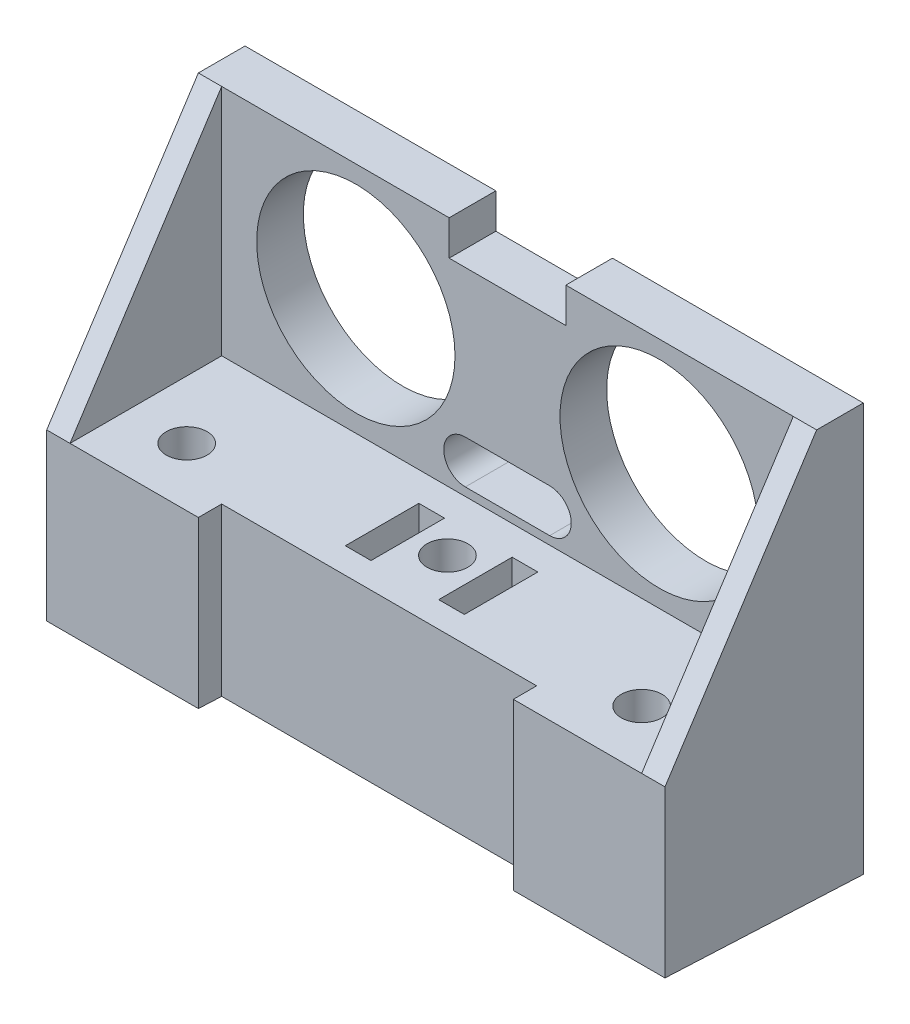
from build123d import *
from build123d.topology import SkipClean

# Parameters (mm, degrees)
SKETCH1_R           = 8.5
BOSS_EXTRUDE1_DEPTH = 4
BOSS_EXTRUDE2_DEPTH = 13
SKETCH3_W           = 2.2
SKETCH3_H           = 6.3
CUT_EXTRUDE1_DEPTH  = 3.5
SKETCH4_R           = 1.75
CUT_EXTRUDE2_DEPTH  = 47.663174732
SKETCH6_W           = 27
SKETCH6_H           = 2
CUT_EXTRUDE4_DEPTH  = 47.663174732
SKETCH7_W           = 2
SKETCH7_H           = 25
BOSS_EXTRUDE3_DEPTH = 17
CUT_EXTRUDE5_DEPTH  = 72
SKETCH9_R           = 1.75
BOSS_EXTRUDE4_DEPTH = 10
SKETCH10_R          = 2.85
CUT_EXTRUDE6_DEPTH  = 12
CUT_EXTRUDE7_DEPTH  = 54


with BuildPart() as part:
    # Sketch1 → Boss-Extrude1 (new body)
    with BuildSketch(Plane.XY):
        Polygon((-10.41954023, 18.706896552), (-10.41954023, -6.293103448), (38.58045977, -6.293103448), (38.58045977, 18.706896552), (19.08045977, 18.706896552), (19.08045977, 15.706896552), (14.08045977, 15.706896552), (9.08045977, 15.706896552), (9.08045977, 18.706896552), align=None)
        with BuildLine():
            ThreePointArc((10.46545977, -0.583103448), (8.61545977, 1.266896552), (10.46545977, 3.116896552))
            Line((10.46545977, 3.116896552), (17.69545977, 3.116896552))
            ThreePointArc((17.69545977, 3.116896552), (19.54545977, 1.266896552), (17.69545977, -0.583103448))
            Line((17.69545977, -0.583103448), (10.46545977, -0.583103448))
        make_face(mode=Mode.SUBTRACT)
        with Locations((1.08045977, 8.706896552)):
            Circle(SKETCH1_R, mode=Mode.SUBTRACT)
        with Locations((27.08045977, 8.706896552)):
            Circle(SKETCH1_R, mode=Mode.SUBTRACT)
    extrude(amount=BOSS_EXTRUDE1_DEPTH)

    # Sketch2 → Boss-Extrude2 (add)
    with BuildSketch(Plane.XY.offset(4)):
        Polygon((14.08045977, -1.293103448), (38.58045977, -1.293103448), (38.58045977, -6.293103448), (-10.41954023, -6.293103448), (-10.41954023, -1.293103448), align=None)
    extrude(amount=BOSS_EXTRUDE2_DEPTH)

    # Sketch3 → Cut-Extrude1 (cut)
    with BuildSketch(Plane(origin=(0, -1.293103448, 0), x_dir=(1, 0, 0), z_dir=(0, 1, 0))):
        with Locations((10.08045977, -9.65)):
            Rectangle(SKETCH3_W, SKETCH3_H)
        with Locations((18.08045977, -9.65)):
            Rectangle(SKETCH3_W, SKETCH3_H)
    extrude(amount=-CUT_EXTRUDE1_DEPTH, mode=Mode.SUBTRACT)

    # Sketch4 → Cut-Extrude2 (cut, through all)
    with BuildSketch(Plane(origin=(0, -1.293103448, 0), x_dir=(1, 0, 0), z_dir=(0, 1, 0))):
        with Locations((14.08045977, -9.15)):
            Circle(SKETCH4_R)
        with Locations((33.58045977, -12)):
            Circle(SKETCH4_R)
        with Locations((-5.41954023, -12)):
            Circle(SKETCH4_R)
    extrude(amount=-CUT_EXTRUDE2_DEPTH, mode=Mode.SUBTRACT)

    # Sketch6 → Cut-Extrude4 (cut, through all)
    with BuildSketch(Plane(origin=(0, -1.293103448, 0), x_dir=(1, 0, 0), z_dir=(0, 1, 0))):
        with Locations((14.08045977, -16)):
            Rectangle(SKETCH6_W, SKETCH6_H)
    extrude(amount=-CUT_EXTRUDE4_DEPTH, mode=Mode.SUBTRACT)

    # Sketch7 → Boss-Extrude3 (add)
    with BuildSketch(Plane(origin=(0, 0, 0), x_dir=(-1, 0, 0), z_dir=(0, 0, -1))):
        with Locations((-39.58045977, 6.206896552)):
            Rectangle(SKETCH7_W, SKETCH7_H)
        with Locations((11.41954023, 6.206896552)):
            Rectangle(SKETCH7_W, SKETCH7_H)
    extrude(amount=-BOSS_EXTRUDE3_DEPTH)

    # Sketch8 → Cut-Extrude5 (cut)
    with BuildSketch(Plane(origin=(40.58045977, 0, 0), x_dir=(0, 0, -1), z_dir=(1, 0, 0))):
        Polygon((-4, 18.706896552), (-17, -1.293103448), (-17, 18.706896552), align=None)
    extrude(amount=-CUT_EXTRUDE5_DEPTH, mode=Mode.SUBTRACT)

    # Sketch9 → Boss-Extrude4 (add)
    with SkipClean():  # the faces are left unmerged after this step: merging them gives an invalid solid
        with BuildSketch(Plane(origin=(0, -6.293103448, 0), x_dir=(-1, 0, 0), z_dir=(0, -1, 0))):
            Polygon((-40.58045977, 0), (-40.58045977, -17), (-27.58045977, -17), (-27.58045977, -15), (-0.58045977, -15), (-0.58045977, -17), (12.41954023, -17), (12.41954023, 0), align=None)
            with Locations((5.41954023, -12)):
                Circle(SKETCH9_R, mode=Mode.SUBTRACT)
            with Locations((-14.08045977, -9.15)):
                Circle(SKETCH9_R, mode=Mode.SUBTRACT)
            with Locations((-33.58045977, -12)):
                Circle(SKETCH9_R, mode=Mode.SUBTRACT)
        extrude(amount=BOSS_EXTRUDE4_DEPTH)

    # Sketch10 → Cut-Extrude6 (cut)
    with SkipClean():  # the faces are left unmerged after this step: merging them gives an invalid solid
        with BuildSketch(Plane(origin=(0, -16.293103448, 0), x_dir=(-1, 0, 0), z_dir=(0, -1, 0))):
            with Locations((-14.08045977, -9.15)):
                Circle(SKETCH10_R)
        extrude(amount=-CUT_EXTRUDE6_DEPTH, mode=Mode.SUBTRACT)

    # Sketch11 → Cut-Extrude7 (cut)
    with SkipClean():  # the faces are left unmerged after this step: merging them gives an invalid solid
        with BuildSketch(Plane.ZY.offset(12.41954023)):
            Polygon((17, -16.293103448), (17, -15.482482603), (0, -16.293103448), align=None)
        extrude(amount=-CUT_EXTRUDE7_DEPTH, mode=Mode.SUBTRACT)


solid = part.part
